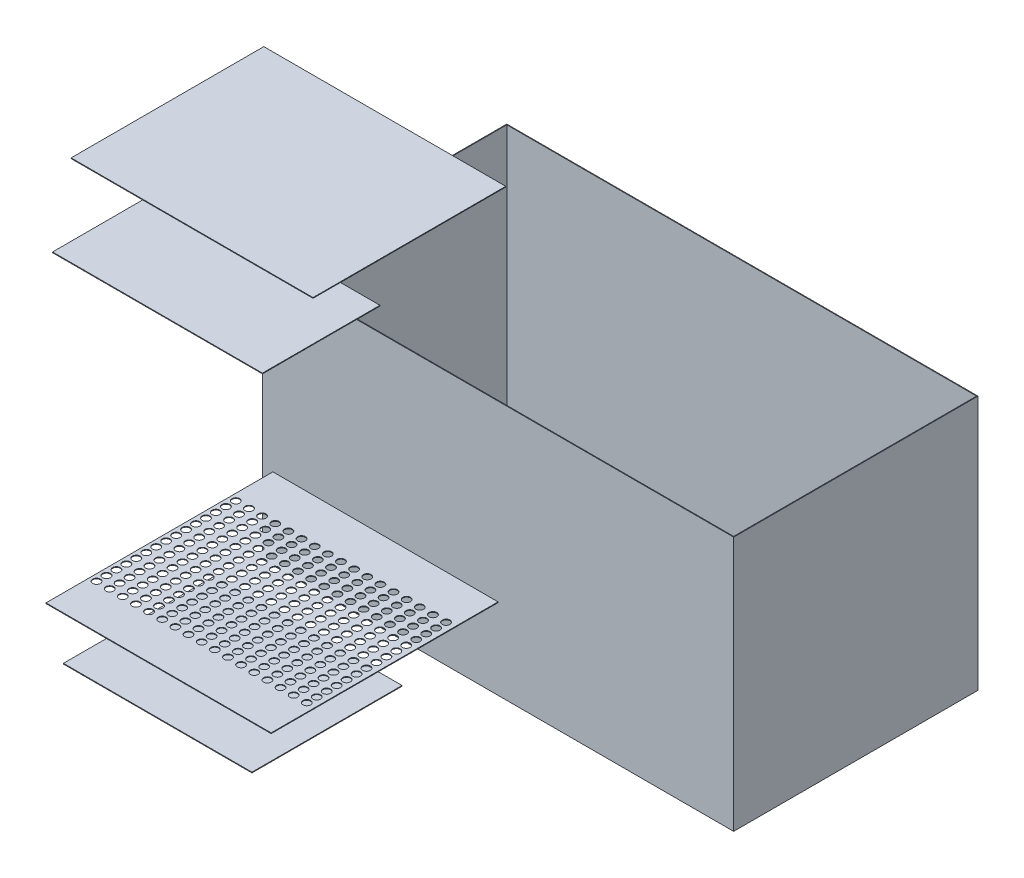
from build123d import *

# Parameters (mm, degrees)
MASTER_FOOTPRINT_W            = 1350
MASTER_FOOTPRINT_H            = 700
BATH_BASE_PLATE_DEPTH         = 750
BATH_SHELL_2MM_T              = -2
INLET_IMPACT_BAFFLE_START     = 125
SKETCH_1_W                    = 540
SKETCH_1_H                    = 430
INLET_IMPACT_BAFFLE_DEPTH     = 2
DISTRIBUTOR_D22_START         = 250
SKETCH_2_W                    = 645
SKETCH_2_H                    = 652
SKETCH_2_R                    = 11
DISTRIBUTOR_D22_DEPTH         = 2
OUTLET_SUBMERGED_BAFFLE_START = 1130
SKETCH_3_W                    = 601.176470588
SKETCH_3_H                    = 336.5
OUTLET_SUBMERGED_BAFFLE_DEPTH = 2
OVERFLOW_WEIR_Z550_START      = 1290
SKETCH_4_W                    = 693
SKETCH_4_H                    = 552
OVERFLOW_WEIR_Z550_DEPTH      = 2
SKETCH_5_OUTSIDE_W            = 1813.054
SKETCH_5_OUTSIDE_H            = 1813.054
SKETCH_5_OUTSIDE_R            = 50
INLET_D100_OPENING_DEPTH      = 20


with BuildPart() as part:
    # MASTER_FOOTPRINT → BATH_BASE_PLATE (new body)
    with BuildSketch(Plane(origin=(0, 0, 0), x_dir=(1, 0, 0), z_dir=(0, 1, 0))):
        with Locations((675, 350)):
            Rectangle(MASTER_FOOTPRINT_W, MASTER_FOOTPRINT_H)
    extrude(amount=BATH_BASE_PLATE_DEPTH)

    # BATH_SHELL_2MM
    bath_shell_2mm_openings = [part.faces().sort_by_distance(p)[0] for p in [
        (675, 750, -350),
    ]]
    offset(amount=BATH_SHELL_2MM_T, openings=bath_shell_2mm_openings, kind=Kind.INTERSECTION)

    # Эскиз5 outside → INLET_D100_OPENING (cut)
    with BuildSketch(Plane(origin=(0, 0, 0), x_dir=(1, 0, 0), z_dir=(0, 1, 0))):
        with Locations((675, 25)):
            Rectangle(SKETCH_5_OUTSIDE_W, SKETCH_5_OUTSIDE_H)
        with Locations((350, -420)):
            Circle(SKETCH_5_OUTSIDE_R, mode=Mode.SUBTRACT)
    extrude(amount=INLET_D100_OPENING_DEPTH, mode=Mode.SUBTRACT)


with BuildPart() as body_2:
    # Эскиз1 → INLET_IMPACT_BAFFLE (new body)
    with BuildSketch(Plane(origin=(0, 0, 0), x_dir=(1, 0, 0), z_dir=(0, 1, 0)).offset(INLET_IMPACT_BAFFLE_START)):
        with Locations((350, -435)):
            Rectangle(SKETCH_1_W, SKETCH_1_H)
    extrude(amount=INLET_IMPACT_BAFFLE_DEPTH)


with BuildPart() as body_3:
    # Эскиз2 → DISTRIBUTOR_D22 (new body)
    with BuildSketch(Plane(origin=(0, 0, 0), x_dir=(1, 0, 0), z_dir=(0, 1, 0)).offset(DISTRIBUTOR_D22_START)):
        with Locations((352.5, -324)):
            Rectangle(SKETCH_2_W, SKETCH_2_H)
        with Locations(Location((48.823529412, -125, 0), (0, 0, 270))):
            Circle(SKETCH_2_R, mode=Mode.SUBTRACT)
        with Locations(Location((48.823529412, -153.5, 0), (0, 0, 270))):
            Circle(SKETCH_2_R, mode=Mode.SUBTRACT)
        with Locations(Location((48.823529412, -182, 0), (0, 0, 270))):
            Circle(SKETCH_2_R, mode=Mode.SUBTRACT)
        with Locations(Location((48.823529412, -210.5, 0), (0, 0, 270))):
            Circle(SKETCH_2_R, mode=Mode.SUBTRACT)
        with Locations(Location((48.823529412, -239, 0), (0, 0, 270))):
            Circle(SKETCH_2_R, mode=Mode.SUBTRACT)
        with Locations(Location((48.823529412, -267.5, 0), (0, 0, 270))):
            Circle(SKETCH_2_R, mode=Mode.SUBTRACT)
        with Locations(Location((48.823529412, -296, 0), (0, 0, 270))):
            Circle(SKETCH_2_R, mode=Mode.SUBTRACT)
        with Locations(Location((48.823529412, -324.5, 0), (0, 0, 270))):
            Circle(SKETCH_2_R, mode=Mode.SUBTRACT)
        with Locations(Location((48.823529412, -353, 0), (0, 0, 270))):
            Circle(SKETCH_2_R, mode=Mode.SUBTRACT)
        with Locations(Location((48.823529412, -381.5, 0), (0, 0, 270))):
            Circle(SKETCH_2_R, mode=Mode.SUBTRACT)
        with Locations(Location((48.823529412, -410, 0), (0, 0, 270))):
            Circle(SKETCH_2_R, mode=Mode.SUBTRACT)
        with Locations(Location((48.823529412, -438.5, 0), (0, 0, 270))):
            Circle(SKETCH_2_R, mode=Mode.SUBTRACT)
        with Locations(Location((48.823529412, -467, 0), (0, 0, 270))):
            Circle(SKETCH_2_R, mode=Mode.SUBTRACT)
        with Locations(Location((48.823529412, -495.5, 0), (0, 0, 270))):
            Circle(SKETCH_2_R, mode=Mode.SUBTRACT)
        with Locations(Location((48.823529412, -524, 0), (0, 0, 270))):
            Circle(SKETCH_2_R, mode=Mode.SUBTRACT)
        with Locations(Location((86.470588235, -125, 0), (0, 0, 270))):
            Circle(SKETCH_2_R, mode=Mode.SUBTRACT)
        with Locations(Location((86.470588235, -153.5, 0), (0, 0, 270))):
            Circle(SKETCH_2_R, mode=Mode.SUBTRACT)
        with Locations(Location((86.470588235, -182, 0), (0, 0, 270))):
            Circle(SKETCH_2_R, mode=Mode.SUBTRACT)
        with Locations(Location((86.470588235, -210.5, 0), (0, 0, 270))):
            Circle(SKETCH_2_R, mode=Mode.SUBTRACT)
        with Locations(Location((86.470588235, -239, 0), (0, 0, 270))):
            Circle(SKETCH_2_R, mode=Mode.SUBTRACT)
        with Locations(Location((86.470588235, -267.5, 0), (0, 0, 270))):
            Circle(SKETCH_2_R, mode=Mode.SUBTRACT)
        with Locations(Location((86.470588235, -296, 0), (0, 0, 270))):
            Circle(SKETCH_2_R, mode=Mode.SUBTRACT)
        with Locations(Location((86.470588235, -324.5, 0), (0, 0, 270))):
            Circle(SKETCH_2_R, mode=Mode.SUBTRACT)
        with Locations(Location((86.470588235, -353, 0), (0, 0, 270))):
            Circle(SKETCH_2_R, mode=Mode.SUBTRACT)
        with Locations(Location((86.470588235, -381.5, 0), (0, 0, 270))):
            Circle(SKETCH_2_R, mode=Mode.SUBTRACT)
        with Locations(Location((86.470588235, -410, 0), (0, 0, 270))):
            Circle(SKETCH_2_R, mode=Mode.SUBTRACT)
        with Locations(Location((86.470588235, -438.5, 0), (0, 0, 270))):
            Circle(SKETCH_2_R, mode=Mode.SUBTRACT)
        with Locations(Location((86.470588235, -467, 0), (0, 0, 270))):
            Circle(SKETCH_2_R, mode=Mode.SUBTRACT)
        with Locations(Location((86.470588235, -495.5, 0), (0, 0, 270))):
            Circle(SKETCH_2_R, mode=Mode.SUBTRACT)
        with Locations(Location((86.470588235, -524, 0), (0, 0, 270))):
            Circle(SKETCH_2_R, mode=Mode.SUBTRACT)
        with Locations(Location((124.117647059, -125, 0), (0, 0, 270))):
            Circle(SKETCH_2_R, mode=Mode.SUBTRACT)
        with Locations(Location((124.117647059, -153.5, 0), (0, 0, 270))):
            Circle(SKETCH_2_R, mode=Mode.SUBTRACT)
        with Locations(Location((124.117647059, -182, 0), (0, 0, 270))):
            Circle(SKETCH_2_R, mode=Mode.SUBTRACT)
        with Locations(Location((124.117647059, -210.5, 0), (0, 0, 270))):
            Circle(SKETCH_2_R, mode=Mode.SUBTRACT)
        with Locations(Location((124.117647059, -239, 0), (0, 0, 270))):
            Circle(SKETCH_2_R, mode=Mode.SUBTRACT)
        with Locations(Location((124.117647059, -267.5, 0), (0, 0, 270))):
            Circle(SKETCH_2_R, mode=Mode.SUBTRACT)
        with Locations(Location((124.117647059, -296, 0), (0, 0, 270))):
            Circle(SKETCH_2_R, mode=Mode.SUBTRACT)
        with Locations(Location((124.117647059, -324.5, 0), (0, 0, 270))):
            Circle(SKETCH_2_R, mode=Mode.SUBTRACT)
        with Locations(Location((124.117647059, -353, 0), (0, 0, 270))):
            Circle(SKETCH_2_R, mode=Mode.SUBTRACT)
        with Locations(Location((124.117647059, -381.5, 0), (0, 0, 270))):
            Circle(SKETCH_2_R, mode=Mode.SUBTRACT)
        with Locations(Location((124.117647059, -410, 0), (0, 0, 270))):
            Circle(SKETCH_2_R, mode=Mode.SUBTRACT)
        with Locations(Location((124.117647059, -438.5, 0), (0, 0, 270))):
            Circle(SKETCH_2_R, mode=Mode.SUBTRACT)
        with Locations(Location((124.117647059, -467, 0), (0, 0, 270))):
            Circle(SKETCH_2_R, mode=Mode.SUBTRACT)
        with Locations(Location((124.117647059, -495.5, 0), (0, 0, 270))):
            Circle(SKETCH_2_R, mode=Mode.SUBTRACT)
        with Locations(Location((124.117647059, -524, 0), (0, 0, 270))):
            Circle(SKETCH_2_R, mode=Mode.SUBTRACT)
        with Locations(Location((161.764705882, -125, 0), (0, 0, 270))):
            Circle(SKETCH_2_R, mode=Mode.SUBTRACT)
        with Locations(Location((161.764705882, -153.5, 0), (0, 0, 270))):
            Circle(SKETCH_2_R, mode=Mode.SUBTRACT)
        with Locations(Location((161.764705882, -182, 0), (0, 0, 270))):
            Circle(SKETCH_2_R, mode=Mode.SUBTRACT)
        with Locations(Location((161.764705882, -210.5, 0), (0, 0, 270))):
            Circle(SKETCH_2_R, mode=Mode.SUBTRACT)
        with Locations(Location((161.764705882, -239, 0), (0, 0, 270))):
            Circle(SKETCH_2_R, mode=Mode.SUBTRACT)
        with Locations(Location((161.764705882, -267.5, 0), (0, 0, 270))):
            Circle(SKETCH_2_R, mode=Mode.SUBTRACT)
        with Locations(Location((161.764705882, -296, 0), (0, 0, 270))):
            Circle(SKETCH_2_R, mode=Mode.SUBTRACT)
        with Locations(Location((161.764705882, -324.5, 0), (0, 0, 270))):
            Circle(SKETCH_2_R, mode=Mode.SUBTRACT)
        with Locations(Location((161.764705882, -353, 0), (0, 0, 270))):
            Circle(SKETCH_2_R, mode=Mode.SUBTRACT)
        with Locations(Location((161.764705882, -381.5, 0), (0, 0, 270))):
            Circle(SKETCH_2_R, mode=Mode.SUBTRACT)
        with Locations(Location((161.764705882, -410, 0), (0, 0, 270))):
            Circle(SKETCH_2_R, mode=Mode.SUBTRACT)
        with Locations(Location((161.764705882, -438.5, 0), (0, 0, 270))):
            Circle(SKETCH_2_R, mode=Mode.SUBTRACT)
        with Locations(Location((161.764705882, -467, 0), (0, 0, 270))):
            Circle(SKETCH_2_R, mode=Mode.SUBTRACT)
        with Locations(Location((161.764705882, -495.5, 0), (0, 0, 270))):
            Circle(SKETCH_2_R, mode=Mode.SUBTRACT)
        with Locations(Location((161.764705882, -524, 0), (0, 0, 270))):
            Circle(SKETCH_2_R, mode=Mode.SUBTRACT)
        with Locations(Location((199.411764706, -125, 0), (0, 0, 270))):
            Circle(SKETCH_2_R, mode=Mode.SUBTRACT)
        with Locations(Location((199.411764706, -153.5, 0), (0, 0, 270))):
            Circle(SKETCH_2_R, mode=Mode.SUBTRACT)
        with Locations(Location((199.411764706, -182, 0), (0, 0, 270))):
            Circle(SKETCH_2_R, mode=Mode.SUBTRACT)
        with Locations(Location((199.411764706, -210.5, 0), (0, 0, 270))):
            Circle(SKETCH_2_R, mode=Mode.SUBTRACT)
        with Locations(Location((199.411764706, -239, 0), (0, 0, 270))):
            Circle(SKETCH_2_R, mode=Mode.SUBTRACT)
        with Locations(Location((199.411764706, -267.5, 0), (0, 0, 270))):
            Circle(SKETCH_2_R, mode=Mode.SUBTRACT)
        with Locations(Location((199.411764706, -296, 0), (0, 0, 270))):
            Circle(SKETCH_2_R, mode=Mode.SUBTRACT)
        with Locations(Location((199.411764706, -324.5, 0), (0, 0, 270))):
            Circle(SKETCH_2_R, mode=Mode.SUBTRACT)
        with Locations(Location((199.411764706, -353, 0), (0, 0, 270))):
            Circle(SKETCH_2_R, mode=Mode.SUBTRACT)
        with Locations(Location((199.411764706, -381.5, 0), (0, 0, 270))):
            Circle(SKETCH_2_R, mode=Mode.SUBTRACT)
        with Locations(Location((199.411764706, -410, 0), (0, 0, 270))):
            Circle(SKETCH_2_R, mode=Mode.SUBTRACT)
        with Locations(Location((199.411764706, -438.5, 0), (0, 0, 270))):
            Circle(SKETCH_2_R, mode=Mode.SUBTRACT)
        with Locations(Location((199.411764706, -467, 0), (0, 0, 270))):
            Circle(SKETCH_2_R, mode=Mode.SUBTRACT)
        with Locations(Location((199.411764706, -495.5, 0), (0, 0, 270))):
            Circle(SKETCH_2_R, mode=Mode.SUBTRACT)
        with Locations(Location((199.411764706, -524, 0), (0, 0, 270))):
            Circle(SKETCH_2_R, mode=Mode.SUBTRACT)
        with Locations(Location((237.058823529, -125, 0), (0, 0, 270))):
            Circle(SKETCH_2_R, mode=Mode.SUBTRACT)
        with Locations(Location((237.058823529, -153.5, 0), (0, 0, 270))):
            Circle(SKETCH_2_R, mode=Mode.SUBTRACT)
        with Locations(Location((237.058823529, -182, 0), (0, 0, 270))):
            Circle(SKETCH_2_R, mode=Mode.SUBTRACT)
        with Locations(Location((237.058823529, -210.5, 0), (0, 0, 270))):
            Circle(SKETCH_2_R, mode=Mode.SUBTRACT)
        with Locations(Location((237.058823529, -239, 0), (0, 0, 270))):
            Circle(SKETCH_2_R, mode=Mode.SUBTRACT)
        with Locations(Location((237.058823529, -267.5, 0), (0, 0, 270))):
            Circle(SKETCH_2_R, mode=Mode.SUBTRACT)
        with Locations(Location((237.058823529, -296, 0), (0, 0, 270))):
            Circle(SKETCH_2_R, mode=Mode.SUBTRACT)
        with Locations(Location((237.058823529, -324.5, 0), (0, 0, 270))):
            Circle(SKETCH_2_R, mode=Mode.SUBTRACT)
        with Locations(Location((237.058823529, -353, 0), (0, 0, 270))):
            Circle(SKETCH_2_R, mode=Mode.SUBTRACT)
        with Locations(Location((237.058823529, -381.5, 0), (0, 0, 270))):
            Circle(SKETCH_2_R, mode=Mode.SUBTRACT)
        with Locations(Location((237.058823529, -410, 0), (0, 0, 270))):
            Circle(SKETCH_2_R, mode=Mode.SUBTRACT)
        with Locations(Location((237.058823529, -438.5, 0), (0, 0, 270))):
            Circle(SKETCH_2_R, mode=Mode.SUBTRACT)
        with Locations(Location((237.058823529, -467, 0), (0, 0, 270))):
            Circle(SKETCH_2_R, mode=Mode.SUBTRACT)
        with Locations(Location((237.058823529, -495.5, 0), (0, 0, 270))):
            Circle(SKETCH_2_R, mode=Mode.SUBTRACT)
        with Locations(Location((237.058823529, -524, 0), (0, 0, 270))):
            Circle(SKETCH_2_R, mode=Mode.SUBTRACT)
        with Locations(Location((274.705882353, -125, 0), (0, 0, 270))):
            Circle(SKETCH_2_R, mode=Mode.SUBTRACT)
        with Locations(Location((274.705882353, -153.5, 0), (0, 0, 270))):
            Circle(SKETCH_2_R, mode=Mode.SUBTRACT)
        with Locations(Location((274.705882353, -182, 0), (0, 0, 270))):
            Circle(SKETCH_2_R, mode=Mode.SUBTRACT)
        with Locations(Location((274.705882353, -210.5, 0), (0, 0, 270))):
            Circle(SKETCH_2_R, mode=Mode.SUBTRACT)
        with Locations(Location((274.705882353, -239, 0), (0, 0, 270))):
            Circle(SKETCH_2_R, mode=Mode.SUBTRACT)
        with Locations(Location((274.705882353, -267.5, 0), (0, 0, 270))):
            Circle(SKETCH_2_R, mode=Mode.SUBTRACT)
        with Locations(Location((274.705882353, -296, 0), (0, 0, 270))):
            Circle(SKETCH_2_R, mode=Mode.SUBTRACT)
        with Locations(Location((274.705882353, -324.5, 0), (0, 0, 270))):
            Circle(SKETCH_2_R, mode=Mode.SUBTRACT)
        with Locations(Location((274.705882353, -353, 0), (0, 0, 270))):
            Circle(SKETCH_2_R, mode=Mode.SUBTRACT)
        with Locations(Location((274.705882353, -381.5, 0), (0, 0, 270))):
            Circle(SKETCH_2_R, mode=Mode.SUBTRACT)
        with Locations(Location((274.705882353, -410, 0), (0, 0, 270))):
            Circle(SKETCH_2_R, mode=Mode.SUBTRACT)
        with Locations(Location((274.705882353, -438.5, 0), (0, 0, 270))):
            Circle(SKETCH_2_R, mode=Mode.SUBTRACT)
        with Locations(Location((274.705882353, -467, 0), (0, 0, 270))):
            Circle(SKETCH_2_R, mode=Mode.SUBTRACT)
        with Locations(Location((274.705882353, -495.5, 0), (0, 0, 270))):
            Circle(SKETCH_2_R, mode=Mode.SUBTRACT)
        with Locations(Location((274.705882353, -524, 0), (0, 0, 270))):
            Circle(SKETCH_2_R, mode=Mode.SUBTRACT)
        with Locations(Location((312.352941176, -125, 0), (0, 0, 270))):
            Circle(SKETCH_2_R, mode=Mode.SUBTRACT)
        with Locations(Location((312.352941176, -153.5, 0), (0, 0, 270))):
            Circle(SKETCH_2_R, mode=Mode.SUBTRACT)
        with Locations(Location((312.352941176, -182, 0), (0, 0, 270))):
            Circle(SKETCH_2_R, mode=Mode.SUBTRACT)
        with Locations(Location((312.352941176, -210.5, 0), (0, 0, 270))):
            Circle(SKETCH_2_R, mode=Mode.SUBTRACT)
        with Locations(Location((312.352941176, -239, 0), (0, 0, 270))):
            Circle(SKETCH_2_R, mode=Mode.SUBTRACT)
        with Locations(Location((312.352941176, -267.5, 0), (0, 0, 270))):
            Circle(SKETCH_2_R, mode=Mode.SUBTRACT)
        with Locations(Location((312.352941176, -296, 0), (0, 0, 270))):
            Circle(SKETCH_2_R, mode=Mode.SUBTRACT)
        with Locations(Location((312.352941176, -324.5, 0), (0, 0, 270))):
            Circle(SKETCH_2_R, mode=Mode.SUBTRACT)
        with Locations(Location((312.352941176, -353, 0), (0, 0, 270))):
            Circle(SKETCH_2_R, mode=Mode.SUBTRACT)
        with Locations(Location((312.352941176, -381.5, 0), (0, 0, 270))):
            Circle(SKETCH_2_R, mode=Mode.SUBTRACT)
        with Locations(Location((312.352941176, -410, 0), (0, 0, 270))):
            Circle(SKETCH_2_R, mode=Mode.SUBTRACT)
        with Locations(Location((312.352941176, -438.5, 0), (0, 0, 270))):
            Circle(SKETCH_2_R, mode=Mode.SUBTRACT)
        with Locations(Location((312.352941176, -467, 0), (0, 0, 270))):
            Circle(SKETCH_2_R, mode=Mode.SUBTRACT)
        with Locations(Location((312.352941176, -495.5, 0), (0, 0, 270))):
            Circle(SKETCH_2_R, mode=Mode.SUBTRACT)
        with Locations(Location((312.352941176, -524, 0), (0, 0, 270))):
            Circle(SKETCH_2_R, mode=Mode.SUBTRACT)
        with Locations(Location((350, -125, 0), (0, 0, 270))):
            Circle(SKETCH_2_R, mode=Mode.SUBTRACT)
        with Locations(Location((350, -153.5, 0), (0, 0, 270))):
            Circle(SKETCH_2_R, mode=Mode.SUBTRACT)
        with Locations(Location((350, -182, 0), (0, 0, 270))):
            Circle(SKETCH_2_R, mode=Mode.SUBTRACT)
        with Locations(Location((350, -210.5, 0), (0, 0, 270))):
            Circle(SKETCH_2_R, mode=Mode.SUBTRACT)
        with Locations(Location((350, -239, 0), (0, 0, 270))):
            Circle(SKETCH_2_R, mode=Mode.SUBTRACT)
        with Locations(Location((350, -267.5, 0), (0, 0, 270))):
            Circle(SKETCH_2_R, mode=Mode.SUBTRACT)
        with Locations(Location((350, -296, 0), (0, 0, 270))):
            Circle(SKETCH_2_R, mode=Mode.SUBTRACT)
        with Locations(Location((350, -324.5, 0), (0, 0, 270))):
            Circle(SKETCH_2_R, mode=Mode.SUBTRACT)
        with Locations(Location((350, -353, 0), (0, 0, 270))):
            Circle(SKETCH_2_R, mode=Mode.SUBTRACT)
        with Locations(Location((350, -381.5, 0), (0, 0, 270))):
            Circle(SKETCH_2_R, mode=Mode.SUBTRACT)
        with Locations(Location((350, -410, 0), (0, 0, 270))):
            Circle(SKETCH_2_R, mode=Mode.SUBTRACT)
        with Locations(Location((350, -438.5, 0), (0, 0, 270))):
            Circle(SKETCH_2_R, mode=Mode.SUBTRACT)
        with Locations(Location((350, -467, 0), (0, 0, 270))):
            Circle(SKETCH_2_R, mode=Mode.SUBTRACT)
        with Locations(Location((350, -495.5, 0), (0, 0, 270))):
            Circle(SKETCH_2_R, mode=Mode.SUBTRACT)
        with Locations(Location((350, -524, 0), (0, 0, 270))):
            Circle(SKETCH_2_R, mode=Mode.SUBTRACT)
        with Locations(Location((387.647058824, -125, 0), (0, 0, 270))):
            Circle(SKETCH_2_R, mode=Mode.SUBTRACT)
        with Locations(Location((387.647058824, -153.5, 0), (0, 0, 270))):
            Circle(SKETCH_2_R, mode=Mode.SUBTRACT)
        with Locations(Location((387.647058824, -182, 0), (0, 0, 270))):
            Circle(SKETCH_2_R, mode=Mode.SUBTRACT)
        with Locations(Location((387.647058824, -210.5, 0), (0, 0, 270))):
            Circle(SKETCH_2_R, mode=Mode.SUBTRACT)
        with Locations(Location((387.647058824, -239, 0), (0, 0, 270))):
            Circle(SKETCH_2_R, mode=Mode.SUBTRACT)
        with Locations(Location((387.647058824, -267.5, 0), (0, 0, 270))):
            Circle(SKETCH_2_R, mode=Mode.SUBTRACT)
        with Locations(Location((387.647058824, -296, 0), (0, 0, 270))):
            Circle(SKETCH_2_R, mode=Mode.SUBTRACT)
        with Locations(Location((387.647058824, -324.5, 0), (0, 0, 270))):
            Circle(SKETCH_2_R, mode=Mode.SUBTRACT)
        with Locations(Location((387.647058824, -353, 0), (0, 0, 270))):
            Circle(SKETCH_2_R, mode=Mode.SUBTRACT)
        with Locations(Location((387.647058824, -381.5, 0), (0, 0, 270))):
            Circle(SKETCH_2_R, mode=Mode.SUBTRACT)
        with Locations(Location((387.647058824, -410, 0), (0, 0, 270))):
            Circle(SKETCH_2_R, mode=Mode.SUBTRACT)
        with Locations(Location((387.647058824, -438.5, 0), (0, 0, 270))):
            Circle(SKETCH_2_R, mode=Mode.SUBTRACT)
        with Locations(Location((387.647058824, -467, 0), (0, 0, 270))):
            Circle(SKETCH_2_R, mode=Mode.SUBTRACT)
        with Locations(Location((387.647058824, -495.5, 0), (0, 0, 270))):
            Circle(SKETCH_2_R, mode=Mode.SUBTRACT)
        with Locations(Location((387.647058824, -524, 0), (0, 0, 270))):
            Circle(SKETCH_2_R, mode=Mode.SUBTRACT)
        with Locations(Location((425.294117647, -125, 0), (0, 0, 270))):
            Circle(SKETCH_2_R, mode=Mode.SUBTRACT)
        with Locations(Location((425.294117647, -153.5, 0), (0, 0, 270))):
            Circle(SKETCH_2_R, mode=Mode.SUBTRACT)
        with Locations(Location((425.294117647, -182, 0), (0, 0, 270))):
            Circle(SKETCH_2_R, mode=Mode.SUBTRACT)
        with Locations(Location((425.294117647, -210.5, 0), (0, 0, 270))):
            Circle(SKETCH_2_R, mode=Mode.SUBTRACT)
        with Locations(Location((425.294117647, -239, 0), (0, 0, 270))):
            Circle(SKETCH_2_R, mode=Mode.SUBTRACT)
        with Locations(Location((425.294117647, -267.5, 0), (0, 0, 270))):
            Circle(SKETCH_2_R, mode=Mode.SUBTRACT)
        with Locations(Location((425.294117647, -296, 0), (0, 0, 270))):
            Circle(SKETCH_2_R, mode=Mode.SUBTRACT)
        with Locations(Location((425.294117647, -324.5, 0), (0, 0, 270))):
            Circle(SKETCH_2_R, mode=Mode.SUBTRACT)
        with Locations(Location((425.294117647, -353, 0), (0, 0, 270))):
            Circle(SKETCH_2_R, mode=Mode.SUBTRACT)
        with Locations(Location((425.294117647, -381.5, 0), (0, 0, 270))):
            Circle(SKETCH_2_R, mode=Mode.SUBTRACT)
        with Locations(Location((425.294117647, -410, 0), (0, 0, 270))):
            Circle(SKETCH_2_R, mode=Mode.SUBTRACT)
        with Locations(Location((425.294117647, -438.5, 0), (0, 0, 270))):
            Circle(SKETCH_2_R, mode=Mode.SUBTRACT)
        with Locations(Location((425.294117647, -467, 0), (0, 0, 270))):
            Circle(SKETCH_2_R, mode=Mode.SUBTRACT)
        with Locations(Location((425.294117647, -495.5, 0), (0, 0, 270))):
            Circle(SKETCH_2_R, mode=Mode.SUBTRACT)
        with Locations(Location((425.294117647, -524, 0), (0, 0, 270))):
            Circle(SKETCH_2_R, mode=Mode.SUBTRACT)
        with Locations(Location((462.941176471, -125, 0), (0, 0, 270))):
            Circle(SKETCH_2_R, mode=Mode.SUBTRACT)
        with Locations(Location((462.941176471, -153.5, 0), (0, 0, 270))):
            Circle(SKETCH_2_R, mode=Mode.SUBTRACT)
        with Locations(Location((462.941176471, -182, 0), (0, 0, 270))):
            Circle(SKETCH_2_R, mode=Mode.SUBTRACT)
        with Locations(Location((462.941176471, -210.5, 0), (0, 0, 270))):
            Circle(SKETCH_2_R, mode=Mode.SUBTRACT)
        with Locations(Location((462.941176471, -239, 0), (0, 0, 270))):
            Circle(SKETCH_2_R, mode=Mode.SUBTRACT)
        with Locations(Location((462.941176471, -267.5, 0), (0, 0, 270))):
            Circle(SKETCH_2_R, mode=Mode.SUBTRACT)
        with Locations(Location((462.941176471, -296, 0), (0, 0, 270))):
            Circle(SKETCH_2_R, mode=Mode.SUBTRACT)
        with Locations(Location((462.941176471, -324.5, 0), (0, 0, 270))):
            Circle(SKETCH_2_R, mode=Mode.SUBTRACT)
        with Locations(Location((462.941176471, -353, 0), (0, 0, 270))):
            Circle(SKETCH_2_R, mode=Mode.SUBTRACT)
        with Locations(Location((462.941176471, -381.5, 0), (0, 0, 270))):
            Circle(SKETCH_2_R, mode=Mode.SUBTRACT)
        with Locations(Location((462.941176471, -410, 0), (0, 0, 270))):
            Circle(SKETCH_2_R, mode=Mode.SUBTRACT)
        with Locations(Location((462.941176471, -438.5, 0), (0, 0, 270))):
            Circle(SKETCH_2_R, mode=Mode.SUBTRACT)
        with Locations(Location((462.941176471, -467, 0), (0, 0, 270))):
            Circle(SKETCH_2_R, mode=Mode.SUBTRACT)
        with Locations(Location((462.941176471, -495.5, 0), (0, 0, 270))):
            Circle(SKETCH_2_R, mode=Mode.SUBTRACT)
        with Locations(Location((462.941176471, -524, 0), (0, 0, 270))):
            Circle(SKETCH_2_R, mode=Mode.SUBTRACT)
        with Locations(Location((500.588235294, -125, 0), (0, 0, 270))):
            Circle(SKETCH_2_R, mode=Mode.SUBTRACT)
        with Locations(Location((500.588235294, -153.5, 0), (0, 0, 270))):
            Circle(SKETCH_2_R, mode=Mode.SUBTRACT)
        with Locations(Location((500.588235294, -182, 0), (0, 0, 270))):
            Circle(SKETCH_2_R, mode=Mode.SUBTRACT)
        with Locations(Location((500.588235294, -210.5, 0), (0, 0, 270))):
            Circle(SKETCH_2_R, mode=Mode.SUBTRACT)
        with Locations(Location((500.588235294, -239, 0), (0, 0, 270))):
            Circle(SKETCH_2_R, mode=Mode.SUBTRACT)
        with Locations(Location((500.588235294, -267.5, 0), (0, 0, 270))):
            Circle(SKETCH_2_R, mode=Mode.SUBTRACT)
        with Locations(Location((500.588235294, -296, 0), (0, 0, 270))):
            Circle(SKETCH_2_R, mode=Mode.SUBTRACT)
        with Locations(Location((500.588235294, -324.5, 0), (0, 0, 270))):
            Circle(SKETCH_2_R, mode=Mode.SUBTRACT)
        with Locations(Location((500.588235294, -353, 0), (0, 0, 270))):
            Circle(SKETCH_2_R, mode=Mode.SUBTRACT)
        with Locations(Location((500.588235294, -381.5, 0), (0, 0, 270))):
            Circle(SKETCH_2_R, mode=Mode.SUBTRACT)
        with Locations(Location((500.588235294, -410, 0), (0, 0, 270))):
            Circle(SKETCH_2_R, mode=Mode.SUBTRACT)
        with Locations(Location((500.588235294, -438.5, 0), (0, 0, 270))):
            Circle(SKETCH_2_R, mode=Mode.SUBTRACT)
        with Locations(Location((500.588235294, -467, 0), (0, 0, 270))):
            Circle(SKETCH_2_R, mode=Mode.SUBTRACT)
        with Locations(Location((500.588235294, -495.5, 0), (0, 0, 270))):
            Circle(SKETCH_2_R, mode=Mode.SUBTRACT)
        with Locations(Location((500.588235294, -524, 0), (0, 0, 270))):
            Circle(SKETCH_2_R, mode=Mode.SUBTRACT)
        with Locations(Location((538.235294118, -125, 0), (0, 0, 270))):
            Circle(SKETCH_2_R, mode=Mode.SUBTRACT)
        with Locations(Location((538.235294118, -153.5, 0), (0, 0, 270))):
            Circle(SKETCH_2_R, mode=Mode.SUBTRACT)
        with Locations(Location((538.235294118, -182, 0), (0, 0, 270))):
            Circle(SKETCH_2_R, mode=Mode.SUBTRACT)
        with Locations(Location((538.235294118, -210.5, 0), (0, 0, 270))):
            Circle(SKETCH_2_R, mode=Mode.SUBTRACT)
        with Locations(Location((538.235294118, -239, 0), (0, 0, 270))):
            Circle(SKETCH_2_R, mode=Mode.SUBTRACT)
        with Locations(Location((538.235294118, -267.5, 0), (0, 0, 270))):
            Circle(SKETCH_2_R, mode=Mode.SUBTRACT)
        with Locations(Location((538.235294118, -296, 0), (0, 0, 270))):
            Circle(SKETCH_2_R, mode=Mode.SUBTRACT)
        with Locations(Location((538.235294118, -324.5, 0), (0, 0, 270))):
            Circle(SKETCH_2_R, mode=Mode.SUBTRACT)
        with Locations(Location((538.235294118, -353, 0), (0, 0, 270))):
            Circle(SKETCH_2_R, mode=Mode.SUBTRACT)
        with Locations(Location((538.235294118, -381.5, 0), (0, 0, 270))):
            Circle(SKETCH_2_R, mode=Mode.SUBTRACT)
        with Locations(Location((538.235294118, -410, 0), (0, 0, 270))):
            Circle(SKETCH_2_R, mode=Mode.SUBTRACT)
        with Locations(Location((538.235294118, -438.5, 0), (0, 0, 270))):
            Circle(SKETCH_2_R, mode=Mode.SUBTRACT)
        with Locations(Location((538.235294118, -467, 0), (0, 0, 270))):
            Circle(SKETCH_2_R, mode=Mode.SUBTRACT)
        with Locations(Location((538.235294118, -495.5, 0), (0, 0, 270))):
            Circle(SKETCH_2_R, mode=Mode.SUBTRACT)
        with Locations(Location((538.235294118, -524, 0), (0, 0, 270))):
            Circle(SKETCH_2_R, mode=Mode.SUBTRACT)
        with Locations(Location((575.882352941, -125, 0), (0, 0, 270))):
            Circle(SKETCH_2_R, mode=Mode.SUBTRACT)
        with Locations(Location((575.882352941, -153.5, 0), (0, 0, 270))):
            Circle(SKETCH_2_R, mode=Mode.SUBTRACT)
        with Locations(Location((575.882352941, -182, 0), (0, 0, 270))):
            Circle(SKETCH_2_R, mode=Mode.SUBTRACT)
        with Locations(Location((575.882352941, -210.5, 0), (0, 0, 270))):
            Circle(SKETCH_2_R, mode=Mode.SUBTRACT)
        with Locations(Location((575.882352941, -239, 0), (0, 0, 270))):
            Circle(SKETCH_2_R, mode=Mode.SUBTRACT)
        with Locations(Location((575.882352941, -267.5, 0), (0, 0, 270))):
            Circle(SKETCH_2_R, mode=Mode.SUBTRACT)
        with Locations(Location((575.882352941, -296, 0), (0, 0, 270))):
            Circle(SKETCH_2_R, mode=Mode.SUBTRACT)
        with Locations(Location((575.882352941, -324.5, 0), (0, 0, 270))):
            Circle(SKETCH_2_R, mode=Mode.SUBTRACT)
        with Locations(Location((575.882352941, -353, 0), (0, 0, 270))):
            Circle(SKETCH_2_R, mode=Mode.SUBTRACT)
        with Locations(Location((575.882352941, -381.5, 0), (0, 0, 270))):
            Circle(SKETCH_2_R, mode=Mode.SUBTRACT)
        with Locations(Location((575.882352941, -410, 0), (0, 0, 270))):
            Circle(SKETCH_2_R, mode=Mode.SUBTRACT)
        with Locations(Location((575.882352941, -438.5, 0), (0, 0, 270))):
            Circle(SKETCH_2_R, mode=Mode.SUBTRACT)
        with Locations(Location((575.882352941, -467, 0), (0, 0, 270))):
            Circle(SKETCH_2_R, mode=Mode.SUBTRACT)
        with Locations(Location((575.882352941, -495.5, 0), (0, 0, 270))):
            Circle(SKETCH_2_R, mode=Mode.SUBTRACT)
        with Locations(Location((575.882352941, -524, 0), (0, 0, 270))):
            Circle(SKETCH_2_R, mode=Mode.SUBTRACT)
        with Locations(Location((613.529411765, -125, 0), (0, 0, 270))):
            Circle(SKETCH_2_R, mode=Mode.SUBTRACT)
        with Locations(Location((613.529411765, -153.5, 0), (0, 0, 270))):
            Circle(SKETCH_2_R, mode=Mode.SUBTRACT)
        with Locations(Location((613.529411765, -182, 0), (0, 0, 270))):
            Circle(SKETCH_2_R, mode=Mode.SUBTRACT)
        with Locations(Location((613.529411765, -210.5, 0), (0, 0, 270))):
            Circle(SKETCH_2_R, mode=Mode.SUBTRACT)
        with Locations(Location((613.529411765, -239, 0), (0, 0, 270))):
            Circle(SKETCH_2_R, mode=Mode.SUBTRACT)
        with Locations(Location((613.529411765, -267.5, 0), (0, 0, 270))):
            Circle(SKETCH_2_R, mode=Mode.SUBTRACT)
        with Locations(Location((613.529411765, -296, 0), (0, 0, 270))):
            Circle(SKETCH_2_R, mode=Mode.SUBTRACT)
        with Locations(Location((613.529411765, -324.5, 0), (0, 0, 270))):
            Circle(SKETCH_2_R, mode=Mode.SUBTRACT)
        with Locations(Location((613.529411765, -353, 0), (0, 0, 270))):
            Circle(SKETCH_2_R, mode=Mode.SUBTRACT)
        with Locations(Location((613.529411765, -381.5, 0), (0, 0, 270))):
            Circle(SKETCH_2_R, mode=Mode.SUBTRACT)
        with Locations(Location((613.529411765, -410, 0), (0, 0, 270))):
            Circle(SKETCH_2_R, mode=Mode.SUBTRACT)
        with Locations(Location((613.529411765, -438.5, 0), (0, 0, 270))):
            Circle(SKETCH_2_R, mode=Mode.SUBTRACT)
        with Locations(Location((613.529411765, -467, 0), (0, 0, 270))):
            Circle(SKETCH_2_R, mode=Mode.SUBTRACT)
        with Locations(Location((613.529411765, -495.5, 0), (0, 0, 270))):
            Circle(SKETCH_2_R, mode=Mode.SUBTRACT)
        with Locations(Location((613.529411765, -524, 0), (0, 0, 270))):
            Circle(SKETCH_2_R, mode=Mode.SUBTRACT)
        with Locations(Location((651.176470588, -125, 0), (0, 0, 270))):
            Circle(SKETCH_2_R, mode=Mode.SUBTRACT)
        with Locations(Location((651.176470588, -153.5, 0), (0, 0, 270))):
            Circle(SKETCH_2_R, mode=Mode.SUBTRACT)
        with Locations(Location((651.176470588, -182, 0), (0, 0, 270))):
            Circle(SKETCH_2_R, mode=Mode.SUBTRACT)
        with Locations(Location((651.176470588, -210.5, 0), (0, 0, 270))):
            Circle(SKETCH_2_R, mode=Mode.SUBTRACT)
        with Locations(Location((651.176470588, -239, 0), (0, 0, 270))):
            Circle(SKETCH_2_R, mode=Mode.SUBTRACT)
        with Locations(Location((651.176470588, -267.5, 0), (0, 0, 270))):
            Circle(SKETCH_2_R, mode=Mode.SUBTRACT)
        with Locations(Location((651.176470588, -296, 0), (0, 0, 270))):
            Circle(SKETCH_2_R, mode=Mode.SUBTRACT)
        with Locations(Location((651.176470588, -324.5, 0), (0, 0, 270))):
            Circle(SKETCH_2_R, mode=Mode.SUBTRACT)
        with Locations(Location((651.176470588, -353, 0), (0, 0, 270))):
            Circle(SKETCH_2_R, mode=Mode.SUBTRACT)
        with Locations(Location((651.176470588, -381.5, 0), (0, 0, 270))):
            Circle(SKETCH_2_R, mode=Mode.SUBTRACT)
        with Locations(Location((651.176470588, -410, 0), (0, 0, 270))):
            Circle(SKETCH_2_R, mode=Mode.SUBTRACT)
        with Locations(Location((651.176470588, -438.5, 0), (0, 0, 270))):
            Circle(SKETCH_2_R, mode=Mode.SUBTRACT)
        with Locations(Location((651.176470588, -467, 0), (0, 0, 270))):
            Circle(SKETCH_2_R, mode=Mode.SUBTRACT)
        with Locations(Location((651.176470588, -495.5, 0), (0, 0, 270))):
            Circle(SKETCH_2_R, mode=Mode.SUBTRACT)
        with Locations(Location((651.176470588, -524, 0), (0, 0, 270))):
            Circle(SKETCH_2_R, mode=Mode.SUBTRACT)
    extrude(amount=DISTRIBUTOR_D22_DEPTH)


with BuildPart() as body_4:
    # Эскиз3 → OUTLET_SUBMERGED_BAFFLE (new body)
    with BuildSketch(Plane(origin=(0, 0, 0), x_dir=(1, 0, 0), z_dir=(0, 1, 0)).offset(OUTLET_SUBMERGED_BAFFLE_START)):
        with Locations((349.411764706, -481.75)):
            Rectangle(SKETCH_3_W, SKETCH_3_H)
    extrude(amount=OUTLET_SUBMERGED_BAFFLE_DEPTH)


with BuildPart() as body_5:
    # Эскиз4 → OVERFLOW_WEIR_Z550 (new body)
    with BuildSketch(Plane(origin=(0, 0, 0), x_dir=(1, 0, 0), z_dir=(0, 1, 0)).offset(OVERFLOW_WEIR_Z550_START)):
        with Locations((348.5, -274)):
            Rectangle(SKETCH_4_W, SKETCH_4_H)
    extrude(amount=OVERFLOW_WEIR_Z550_DEPTH)


solid = Compound([part.part, body_2.part, body_3.part, body_4.part, body_5.part])
